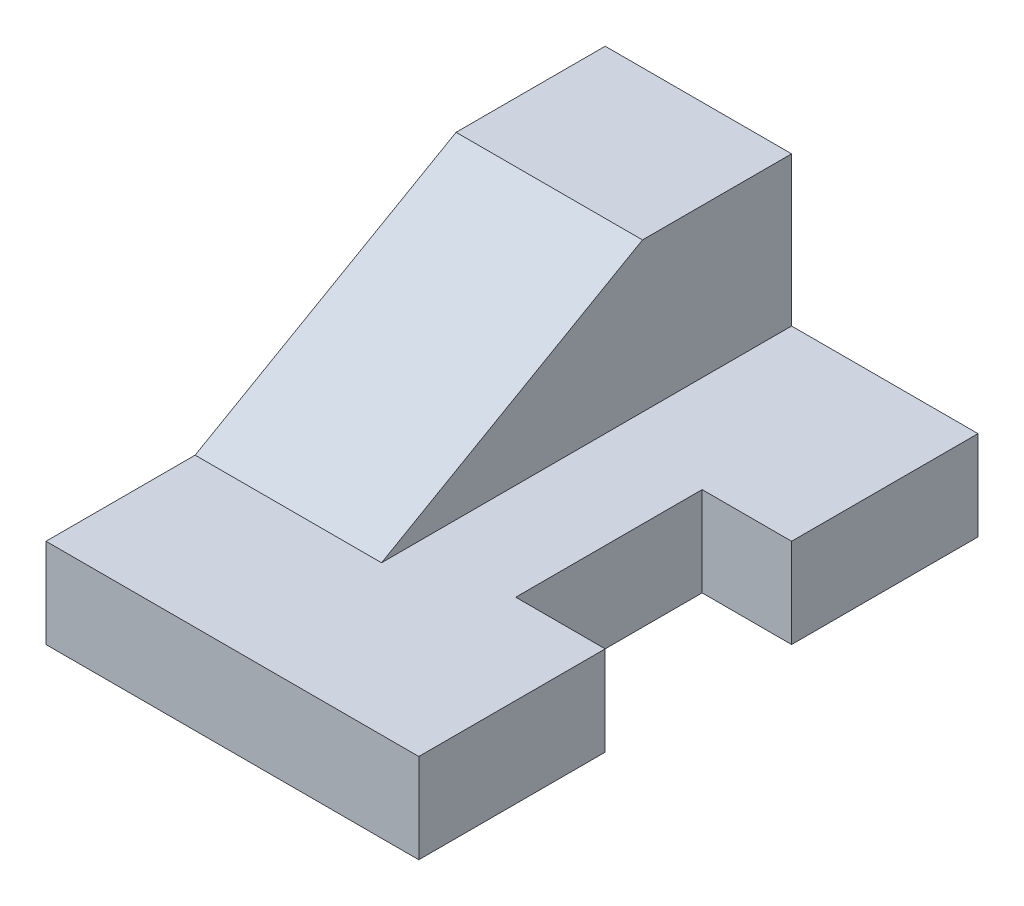
from build123d import *

# Parameters (mm, degrees)
BOSS_EXTRUDE1_DEPTH = 12
BOSS_EXTRUDE3_DEPTH = 25


with BuildPart() as part:
    # Sketch1 → Boss-Extrude1 (new body)
    with BuildSketch(Plane(origin=(0, 0, 0), x_dir=(1, 0, 0), z_dir=(0, 1, 0))):
        Polygon((0, 0), (0, 75), (50, 75), (50, 50), (38, 50), (38, 25), (50, 25), (50, 0), align=None)
    extrude(amount=BOSS_EXTRUDE1_DEPTH)

    # Sketch6 → Boss-Extrude3 (add)
    with BuildSketch(Plane.ZY):
        Polygon((-55, 32), (-20, 12), (-55, 12), (-75, 12), (-75, 32), align=None)
    extrude(amount=-BOSS_EXTRUDE3_DEPTH)


solid = part.part
